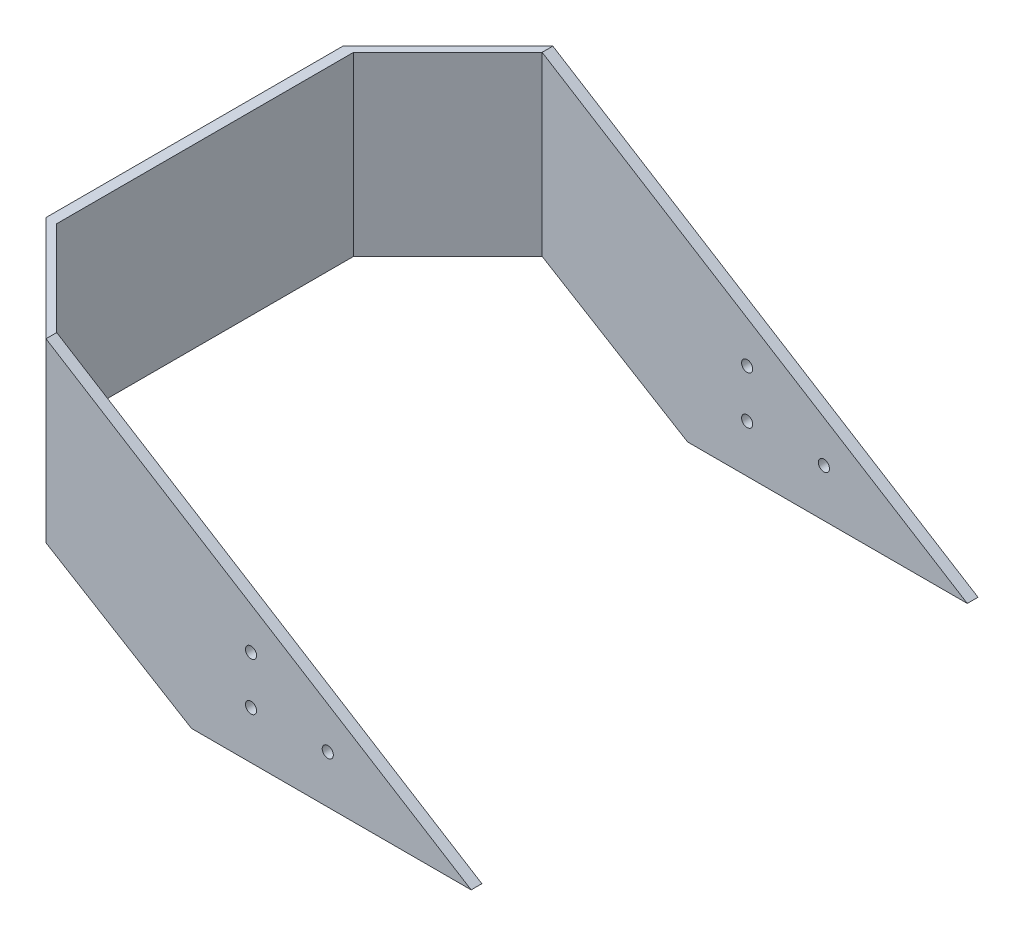
from build123d import *

# Parameters (mm, degrees)
SKETCH5_W                = 6.35
SKETCH5_H                = 176
BOSS_EXTRUDE1_DEPTH      = 104.775666
BOSS_EXTRUDE2_DEPTH      = 6.35
BOSS_EXTRUDE3_DEPTH      = 6.35
M6_CLEARANCE_HOLE5_D     = 6.6
M6_CLEARANCE_HOLE5_DEPTH = 6.35
M6_CLEARANCE_HOLE4_D     = 6.6


with BuildPart() as part:
    # Sketch5 → Boss-Extrude1 (new body)
    with BuildSketch(Plane(origin=(0, 52.149159956, 0), x_dir=(1, 0, 0), z_dir=(0, 1, 0))):
        with Locations((-311.081896744, 0)):
            Rectangle(SKETCH5_W, SKETCH5_H)
        Polygon((-252.0315, -143.875396744), (-307.906896744, -88), (-314.256896744, -88), (-252.0315, -150.225396744), align=None)
        Polygon((-307.906896744, 88), (-252.0315, 143.875396744), (-252.0315, 150.225396744), (-314.256896744, 88), align=None)
    extrude(amount=BOSS_EXTRUDE1_DEPTH)

    # Sketch3 → Boss-Extrude2 (add)
    with BuildSketch(Plane.XY.offset(150.225396744)):
        Polygon((-130.499303898, 0), (-39.48466449, 0), (-84.991984194, 28.335711553), (-130.499303898, 28.335711553), align=None)
        Polygon((-39.48466449, 0), (0, 0), (-119.473415555, 74.388895455), (-165.790897492, 0), (-130.499303898, 0), (-130.499303898, 28.335711553), (-130.499303898, 56.671423106), (-84.991984194, 28.335711553), align=None)
        Polygon((-165.790897492, 0), (-119.473415555, 74.388895455), (-165.790897492, 103.228), align=None)
        Polygon((-130.499303898, 28.335711553), (-84.991984194, 28.335711553), (-130.499303898, 56.671423106), align=None)
        Polygon((-165.790897492, 0), (-165.790897492, 103.228), (-252.0315, 156.924825642), (-252.0315, 52.149159956), align=None)
    extrude(amount=-BOSS_EXTRUDE2_DEPTH)

    # Sketch8 → Boss-Extrude3 (add)
    with BuildSketch(Plane.XY.offset(-150.225396744)):
        Polygon((-165.790897492, 0), (-165.790897492, 103.228), (-252.0315, 156.924825642), (-252.0315, 52.149159956), align=None)
        Polygon((-165.790897492, 0), (-119.473415555, 74.388895455), (-165.790897492, 103.228), align=None)
        Polygon((-39.48466449, 0), (0, 0), (-119.473415555, 74.388895455), (-165.790897492, 0), (-130.499303898, 0), (-130.499303898, 28.335711553), (-130.499303898, 56.671423106), (-84.991984194, 28.335711553), align=None)
        Polygon((-130.499303898, 0), (-39.48466449, 0), (-84.991984194, 28.335711553), (-130.499303898, 28.335711553), align=None)
        Polygon((-130.499303898, 28.335711553), (-84.991984194, 28.335711553), (-130.499303898, 56.671423106), align=None)
    extrude(amount=BOSS_EXTRUDE3_DEPTH)

    # M6 Clearance Hole5
    with Locations(Plane(origin=(0, 0, -150.225396744), x_dir=(1, 0, 0), z_dir=(0, 0, -1))):
        with Locations((-84.991984194, -28.335711553), (-130.499303898, -28.335711553), (-130.499303898, -56.671423106)):
            Hole(M6_CLEARANCE_HOLE5_D / 2, depth=M6_CLEARANCE_HOLE5_DEPTH)

    # M6 Clearance Hole4 (through all)
    with Locations(Plane.XY.offset(150.225396744)):
        with Locations((-84.991984194, 28.335711553), (-130.499303898, 28.335711553), (-130.499303898, 56.671423106)):
            Hole(M6_CLEARANCE_HOLE4_D / 2)


solid = part.part
